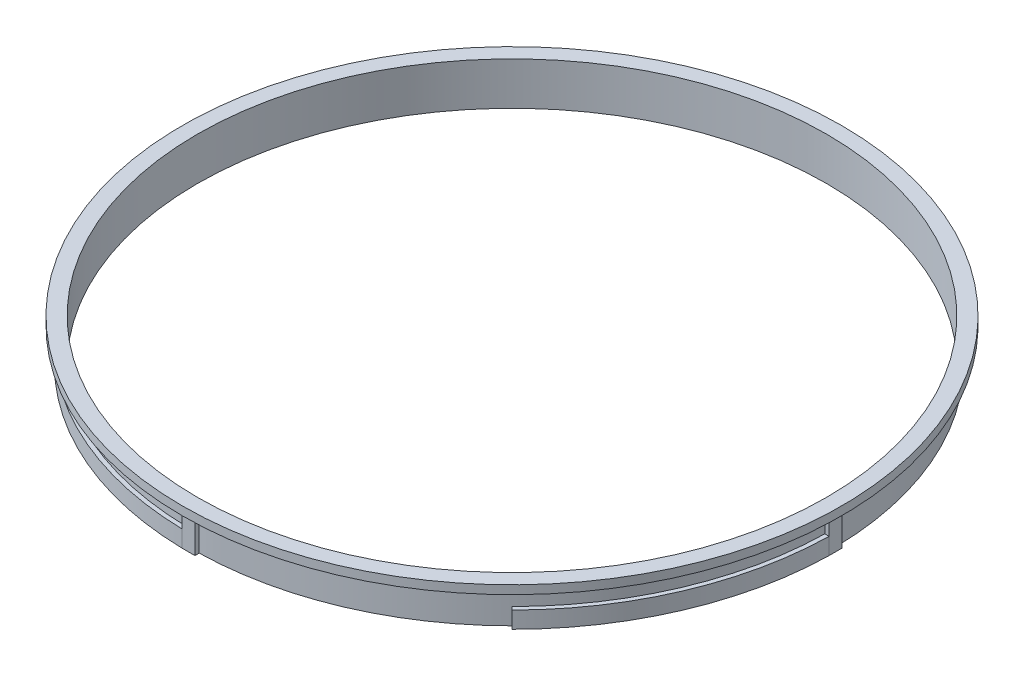
from build123d import *

# Parameters (mm, degrees)
SKETCH_1_R      = 74.6
SKETCH_1_R_2    = 73.5
EXTRUDE_1_DEPTH = 10
SKETCH_2_W      = 1
SKETCH_2_H      = 3
SKETCH_2_W_2    = 3
SKETCH_2_H_2    = 1
EXTRUDE_2_DEPTH = 10
EXTRUDE_4_DEPTH = 3.9
EXTRUDE_START   = -2
SKETCH_4_R      = 77
SKETCH_4_R_2    = 74.6
EXTRUDE_5_DEPTH = 2


with BuildPart() as part:
    # 草图1 → 凸台-拉伸1 (new body)
    with BuildSketch(Plane(origin=(0, 0, 0), x_dir=(1, 0, 0), z_dir=(0, 1, 0))):
        with Locations(Location((0, 0, 0), (0, 0, 270))):
            Circle(SKETCH_1_R)
        with Locations(Location((0, 0, 0), (0, 0, 270))):
            Circle(SKETCH_1_R_2, mode=Mode.SUBTRACT)
    extrude(amount=EXTRUDE_1_DEPTH)

    # 草图2 → 凸台-拉伸2 (add)
    with BuildSketch(Plane(origin=(0, 0, 0), x_dir=(1, 0, 0), z_dir=(0, 1, 0))):
        with Locations((75.084918046, 0)):
            Rectangle(SKETCH_2_W, SKETCH_2_H)
        with Locations((0, -75.084918046)):
            Rectangle(SKETCH_2_W_2, SKETCH_2_H_2)
        with Locations((-75.084918046, 0)):
            Rectangle(SKETCH_2_W, SKETCH_2_H)
        with Locations((0, 75.084918046)):
            Rectangle(SKETCH_2_W_2, SKETCH_2_H_2)
    extrude(amount=EXTRUDE_2_DEPTH)

    # 草图3 → 凸台-拉伸4 (add)
    with BuildSketch(Plane(origin=(0, 0, 0), x_dir=(1, 0, 0), z_dir=(0, 1, 0))):
        with BuildLine():
            ThreePointArc((53.457131592, 53.457131592), (29.622311043, 69.554644162), (1.5, 75.584918046))
            Line((1.5, 75.584918046), (1.5, 74.584918046))
            ThreePointArc((1.5, 74.584918046), (29.239685788, 68.630902478), (52.750165877, 52.750165877))
            Line((52.750165877, 52.750165877), (53.457131592, 53.457131592))
        make_face()
        with BuildLine():
            Line((52.750165877, -52.750165877), (53.457131592, -53.457131592))
            ThreePointArc((53.457131592, -53.457131592), (69.554644162, -29.622311043), (75.584918046, -1.5))
            Line((75.584918046, -1.5), (74.584918046, -1.5))
            ThreePointArc((74.584918046, -1.5), (68.630902478, -29.239685788), (52.750165877, -52.750165877))
        make_face()
        with BuildLine():
            Line((-52.750165877, -52.750165877), (-53.457131592, -53.457131592))
            ThreePointArc((-53.457131592, -53.457131592), (-29.622311043, -69.554644162), (-1.5, -75.584918046))
            Line((-1.5, -75.584918046), (-1.5, -74.584918046))
            ThreePointArc((-1.5, -74.584918046), (-29.239685788, -68.630902478), (-52.750165877, -52.750165877))
        make_face()
        with BuildLine():
            Line((-52.750165877, 52.750165877), (-53.457131592, 53.457131592))
            ThreePointArc((-53.457131592, 53.457131592), (-69.554644162, 29.622311043), (-75.584918046, 1.5))
            Line((-75.584918046, 1.5), (-74.584918046, 1.5))
            ThreePointArc((-74.584918046, 1.5), (-68.630902478, 29.239685788), (-52.750165877, 52.750165877))
        make_face()
    extrude(amount=EXTRUDE_4_DEPTH)

    # 草图4 → 凸台-拉伸5 (add)
    with BuildSketch(Plane(origin=(0, 10, 0), x_dir=(1, 0, 0), z_dir=(0, 1, 0)).offset(EXTRUDE_START)):
        with Locations(Location((0, 0, 0), (0, 0, 270))):
            Circle(SKETCH_4_R)
        Circle(SKETCH_4_R_2, mode=Mode.SUBTRACT)
    extrude(amount=EXTRUDE_5_DEPTH)


solid = part.part
